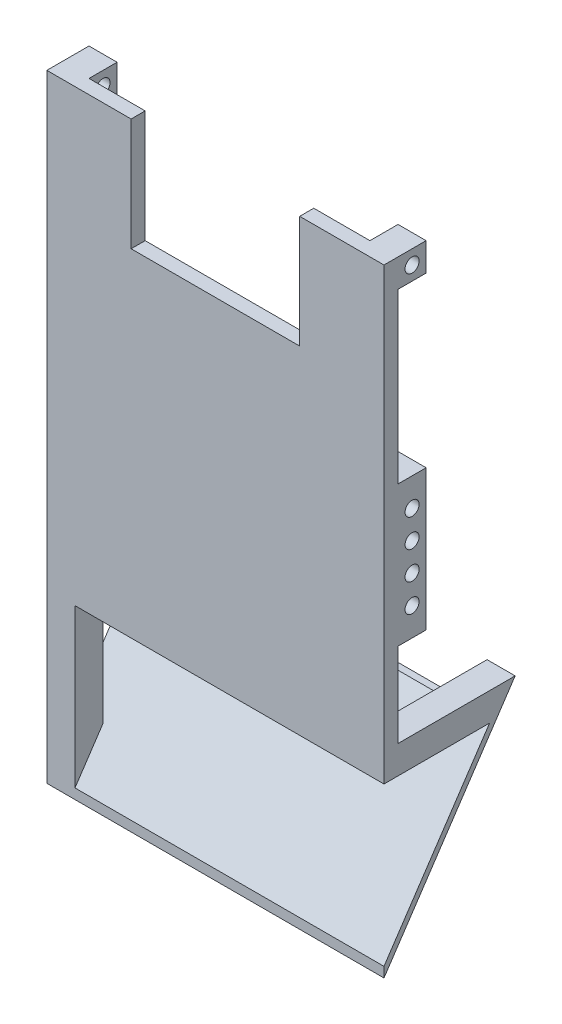
from build123d import *

# Parameters (mm, degrees)
SKETCH1_W               = 152.4
SKETCH1_H               = 203.2
BOSS_EXTRUDE1_DEPTH     = 6.35
CUT_EXTRUDE1_DEPTH      = 255.079362602
CUT_EXTRUDE1_DEPTH_BACK = 255.079362602
SKETCH2_W               = 76.2
SKETCH2_H               = 50.8
SKETCH3_W               = 12.7
SKETCH3_H               = 12.7
SKETCH3_H_2             = 63.5
BOSS_EXTRUDE2_DEPTH     = 12.7
SKETCH4_R               = 3.175
CUT_EXTRUDE2_DEPTH      = 247.916220609
BOSS_EXTRUDE3_DEPTH     = 152.4
BOSS_EXTRUDE5_REACH     = 259.86
SKETCH11_W              = 12.72505143
SKETCH11_H              = 12.7
BOSS_EXTRUDE8_REACH     = 259.86
SKETCH13_W              = 12.7
SKETCH13_H              = 12.7


with BuildPart() as part:
    # Sketch1 → Boss-Extrude1 (new body)
    with BuildSketch(Plane.XY):
        with Locations((-76.2, 101.6)):
            Rectangle(SKETCH1_W, SKETCH1_H)
    extrude(amount=BOSS_EXTRUDE1_DEPTH)

    # Sketch2 → Cut-Extrude1 (cut, two sides: drawn at the far end of the back side and taken through both)
    with BuildSketch(Plane.XY.offset(6.35).offset(-CUT_EXTRUDE1_DEPTH_BACK)):
        with Locations((-76.2, 177.8)):
            Rectangle(SKETCH2_W, SKETCH2_H)
    extrude(amount=CUT_EXTRUDE1_DEPTH + CUT_EXTRUDE1_DEPTH_BACK, mode=Mode.SUBTRACT)

    # Sketch3 → Boss-Extrude2 (add)
    with BuildSketch(Plane(origin=(0, 0, 0), x_dir=(-1, 0, 0), z_dir=(0, 0, -1))):
        with Locations((146.05, 196.85)):
            Rectangle(SKETCH3_W, SKETCH3_H)
        with Locations((146.05, 82.55)):
            Rectangle(SKETCH3_W, SKETCH3_H_2)
    boss_extrude2 = extrude(amount=BOSS_EXTRUDE2_DEPTH)

    # Sketch4 → Cut-Extrude2 (cut, symmetric)
    with BuildSketch(Plane(origin=(-139.7, 0, 0), x_dir=(0, 0, -1), z_dir=(1, 0, 0))):
        with Locations((6.35, 196.85)):
            Circle(SKETCH4_R)
        with Locations((6.35, 101.6)):
            Circle(SKETCH4_R)
        with Locations((6.35, 88.9)):
            Circle(SKETCH4_R)
        with Locations((6.35, 76.2)):
            Circle(SKETCH4_R)
        with Locations((6.35, 63.5)):
            Circle(SKETCH4_R)
    cut_extrude2 = extrude(amount=CUT_EXTRUDE2_DEPTH, both=True, mode=Mode.SUBTRACT)



with BuildPart() as body_2:
    # Sketch6 → Boss-Extrude3 (new body)
    with BuildSketch(Plane(origin=(0, 0, 0), x_dir=(0, 0, -1), z_dir=(1, 0, 0))):
        Polygon((44.45, 0), (-6.35, -75.934955719), (-6.35, -71.366926193), (41.394017446, 0), align=None)
    extrude(amount=-BOSS_EXTRUDE3_DEPTH)


with BuildPart() as body_3:
    # Boss-Extrude5: up to this plane
    boss_extrude5_end = Plane(origin=(-243.760590519, 0, -41.394017446), z_dir=(0, 0.5560384374855327, 0.8311565773298358))
    # Sketch11 → Boss-Extrude5 (new, up to the surface)
    with BuildSketch(Plane(origin=(0, 0, 0), x_dir=(-1, 0, 0), z_dir=(0, -1, 0)), mode=Mode.PRIVATE) as boss_extrude5_sk1:
        with Locations((146.037474285, 0)):
            Rectangle(SKETCH11_W, SKETCH11_H)
    boss_extrude5_tool1 = split(extrude(boss_extrude5_sk1.sketch, amount=BOSS_EXTRUDE5_REACH, mode=Mode.PRIVATE), bisect_by=boss_extrude5_end, keep=Keep.BOTH, mode=Mode.PRIVATE)
    add(boss_extrude5_tool1.solids().sort_by_distance((-146.037474, 0, 0))[0])


with BuildPart() as part_1:
    add(part.part)

    add(body_2.part)  # Boss-Extrude8 merges body 2

    add(body_3.part)  # Boss-Extrude8 merges body 3
    # Boss-Extrude8: up to this plane
    boss_extrude8_end = Plane(origin=(-243.760590519, 0, -44.45), z_dir=(0, -0.5560384374855327, -0.8311565773298358))
    # Sketch13 → Boss-Extrude8 (add, up to the surface)
    with BuildSketch(Plane(origin=(0, 0, 0), x_dir=(-1, 0, 0), z_dir=(0, 0, -1)), mode=Mode.PRIVATE) as boss_extrude8_sk1:
        with Locations((146.05, 6.35)):
            Rectangle(SKETCH13_W, SKETCH13_H)
    boss_extrude8_tool1 = split(extrude(boss_extrude8_sk1.sketch, amount=BOSS_EXTRUDE8_REACH, mode=Mode.PRIVATE), bisect_by=boss_extrude8_end, keep=Keep.BOTH, mode=Mode.PRIVATE)
    boss_extrude8 = boss_extrude8_tool1.solids().sort_by_distance((-146.05, 6.35, 0))[0]
    add(boss_extrude8)

    # Mirror1: Boss-Extrude2, Cut-Extrude2, Boss-Extrude8 across plane
    add(boss_extrude2.mirror(Plane.ZY.offset(76.2)))
    add(cut_extrude2.mirror(Plane.ZY.offset(76.2)), mode=Mode.SUBTRACT)
    add(boss_extrude8.mirror(Plane.ZY.offset(76.2)))


solid = part_1.part
